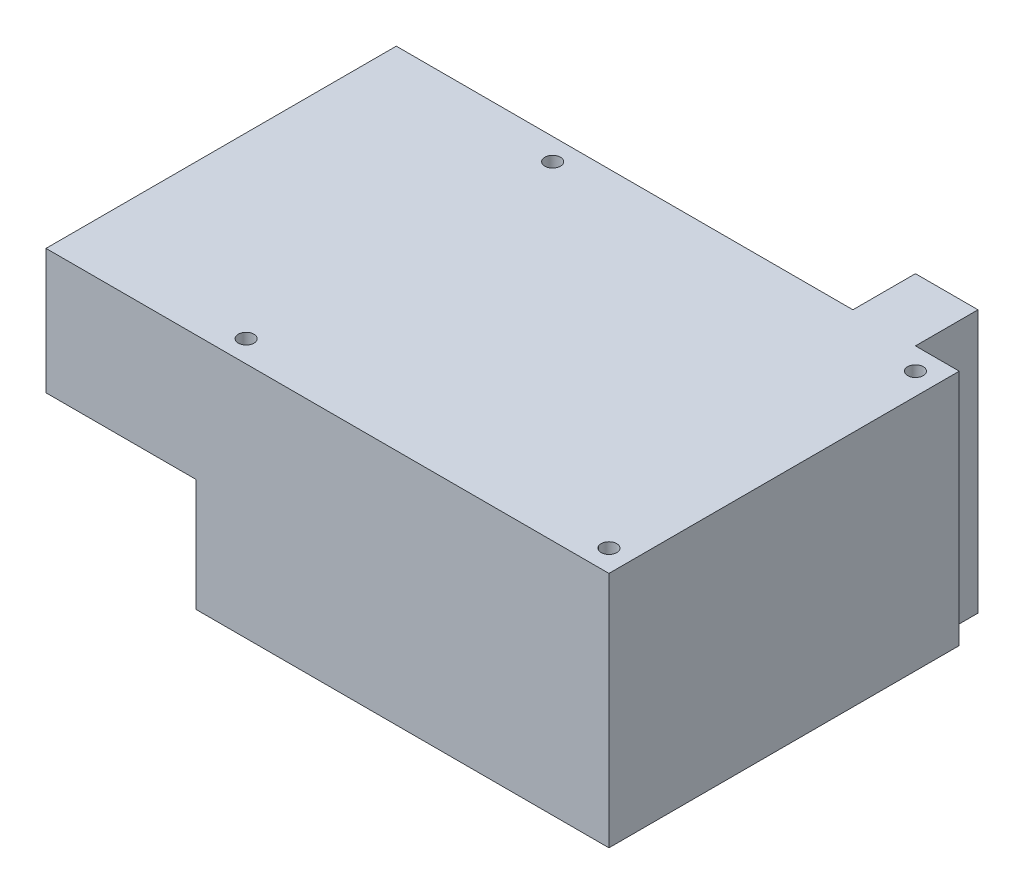
from build123d import *

# Parameters (mm, degrees)
SKETCH_1_W          = 90
SKETCH_1_H          = 56
EXTRUDE_1_DEPTH     = 20
SKETCH_4_W          = 66
SKETCH_4_H          = 56
EXTRUDE_3_DEPTH     = 18
SKETCH_2_R          = 1.25
CUT_EXTRUDE_1_DEPTH = 60
SKETCH_5_W          = 10
SKETCH_5_H          = 10
EXTRUDE_4_DEPTH     = 42


with BuildPart() as part:
    # 草图1 → 凸台-拉伸1 (new body)
    with BuildSketch(Plane(origin=(0, 0, 0), x_dir=(1, 0, 0), z_dir=(0, 1, 0))):
        Rectangle(SKETCH_1_W, SKETCH_1_H)
    extrude(amount=EXTRUDE_1_DEPTH)

    # 草图4 → 凸台-拉伸3 (add)
    with BuildSketch(Plane.XZ):
        with Locations((12, 0)):
            Rectangle(SKETCH_4_W, SKETCH_4_H)
    extrude(amount=EXTRUDE_3_DEPTH)

    # 草图2 → 切除-拉伸1 (cut)
    with BuildSketch(Plane(origin=(0, 20, 0), x_dir=(1, 0, 0), z_dir=(0, 1, 0))):
        with Locations(Location((41.5, 24.5, 0), (0, 0, 270))):
            Circle(SKETCH_2_R)
        with Locations(Location((41.5, -24.5, 0), (0, 0, 90))):
            Circle(SKETCH_2_R)
        with Locations(Location((-16.5, -24.5, 0), (0, 0, 270))):
            Circle(SKETCH_2_R)
        with Locations(Location((-16.5, 24.5, 0), (0, 0, 90))):
            Circle(SKETCH_2_R)
    extrude(amount=-CUT_EXTRUDE_1_DEPTH, mode=Mode.SUBTRACT)

    # 草图5 → 凸台-拉伸4 (add)
    with BuildSketch(Plane(origin=(0, 20, 0), x_dir=(1, 0, 0), z_dir=(0, 1, 0))):
        with Locations((33, 33)):
            Rectangle(SKETCH_5_W, SKETCH_5_H)
    extrude(amount=-EXTRUDE_4_DEPTH)


solid = part.part
